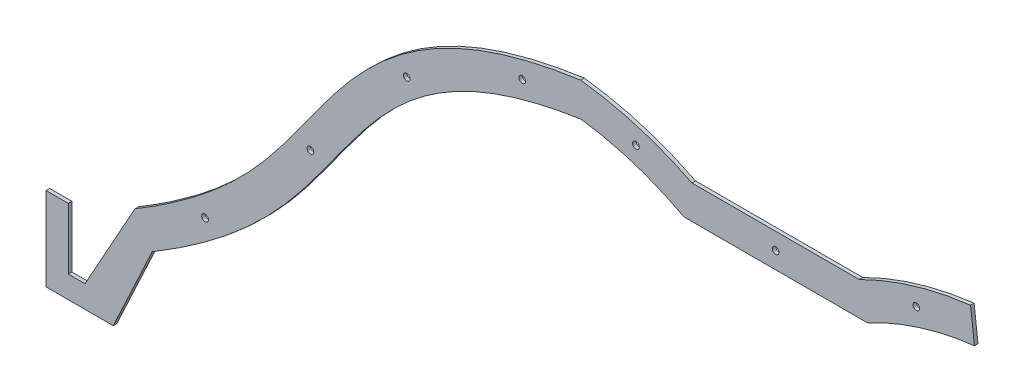
from build123d import *

# Parameters (mm, degrees)
SKETCH1_R           = 3
BOSS_EXTRUDE1_DEPTH = 3.175


with BuildPart() as part:
    # Sketch1 → Boss-Extrude1 (new body)
    with BuildSketch(Plane.XY):
        with BuildLine():
            Line((25, 170), (175, 170))
            ThreePointArc((175, 170), (223.684930832, 189.383563894), (275, 200))
            Line((275, 200), (278.48892965, 170.203567833))
            ThreePointArc((278.48892965, 170.203567833), (228.984362684, 159.629140364), (182.323699215, 140))
            Line((182.323699215, 140), (17.676300785, 140))
            ThreePointArc((17.676300785, 140), (-27.163176857, 159.050053662), (-74.696057289, 169.732215313))
            add(Edge.make_bspline(
                [(-459.597813184, -125.74437106), (-458.167847661, -124.888859924), (-455.300989911, -123.160410804), (-449.693031194, -119.725805066), (-442.844497858, -115.430194443), (-434.897527213, -110.280573748), (-424.643042919, -103.410605598), (-412.446207366, -94.807407336), (-398.73286692, -84.425459971), (-385.875530014, -73.956655832), (-369.787206696, -59.850046206), (-355.152571956, -45.476802835), (-341.718077927, -30.784744771), (-332.160906415, -19.581186548), (-323.101555816, -8.241034683), (-311.630816912, 6.863649777), (-298.117522758, 25.605990916), (-282.395742384, 47.431562205), (-266.384320483, 68.25099024), (-249.34123977, 87.803395961), (-230.504956306, 105.928130356), (-212.601243201, 119.774018212), (-196.457396921, 130.048920131), (-183.303935629, 137.33205425), (-168.969219752, 144.162376514), (-153.317967868, 150.50005901), (-136.218766867, 156.296597686), (-120.658812709, 160.629761276), (-107.364076993, 163.767973943), (-96.958515184, 165.949209965), (-87.903435435, 167.618170459), (-80.445251901, 168.856738216), (-76.604810273, 169.448930821), (-74.696057289, 169.732215313)],
                knots=[0, 0, 0, 0, 0.007772041, 0.015544083, 0.031088165, 0.046632248, 0.06217633, 0.093264496, 0.124352661, 0.155440826, 0.186528991, 0.248705321, 0.279793487, 0.310881652, 0.341969817, 0.373057982, 0.435234312, 0.497410643, 0.559586973, 0.621763303, 0.683939634, 0.746115964, 0.777204129, 0.808292294, 0.83938046, 0.870468625, 0.90155679, 0.932644955, 0.948189038, 0.96373312, 0.979277203, 0.987049244, 0.994821285, 0.994821285, 0.994821285, 0.994821285], degree=3))
            Line((-459.597813184, -125.74437106), (-494.597813184, -200.74437106))
            Line((-494.597813184, -200.74437106), (-554.962766018, -200.74437106))
            Line((-554.962766018, -200.74437106), (-554.962766018, -125.74437106))
            Line((-554.962766018, -125.74437106), (-534.962766018, -125.74437106))
            Line((-534.962766018, -125.74437106), (-534.962766018, -180.74437106))
            Line((-534.962766018, -180.74437106), (-519.962766018, -180.74437106))
            Line((-519.962766018, -180.74437106), (-475, -100))
            add(Edge.make_bspline(
                [(-475, -100), (-419.540575809, -66.820070684), (-306.013905785, 34.036801702), (-257.635554762, 174.287094016), (-75, 200)],
                knots=[0, 0, 0, 0, 0.312223899, 1, 1, 1, 1], degree=3))
            ThreePointArc((-75, 200), (-23.684930832, 189.383563894), (25, 170))
        make_face()
        with Locations((-412.174499428, -75.74437106)):
            Circle(SKETCH1_R, mode=Mode.SUBTRACT)
        with Locations((-317.601811803, 24.25562894)):
            Circle(SKETCH1_R, mode=Mode.SUBTRACT)
        with Locations((-231.096695012, 124.25562894)):
            Circle(SKETCH1_R, mode=Mode.SUBTRACT)
        with Locations((-127.411512689, 174.25562894)):
            Circle(SKETCH1_R, mode=Mode.SUBTRACT)
        with Locations((100, 155)):
            Circle(SKETCH1_R, mode=Mode.SUBTRACT)
        with Locations((226.311251147, 174.505328628)):
            Circle(SKETCH1_R, mode=Mode.SUBTRACT)
        with Locations((-25.392583218, 174.221837866)):
            Circle(SKETCH1_R, mode=Mode.SUBTRACT)
    extrude(amount=BOSS_EXTRUDE1_DEPTH)


solid = part.part
